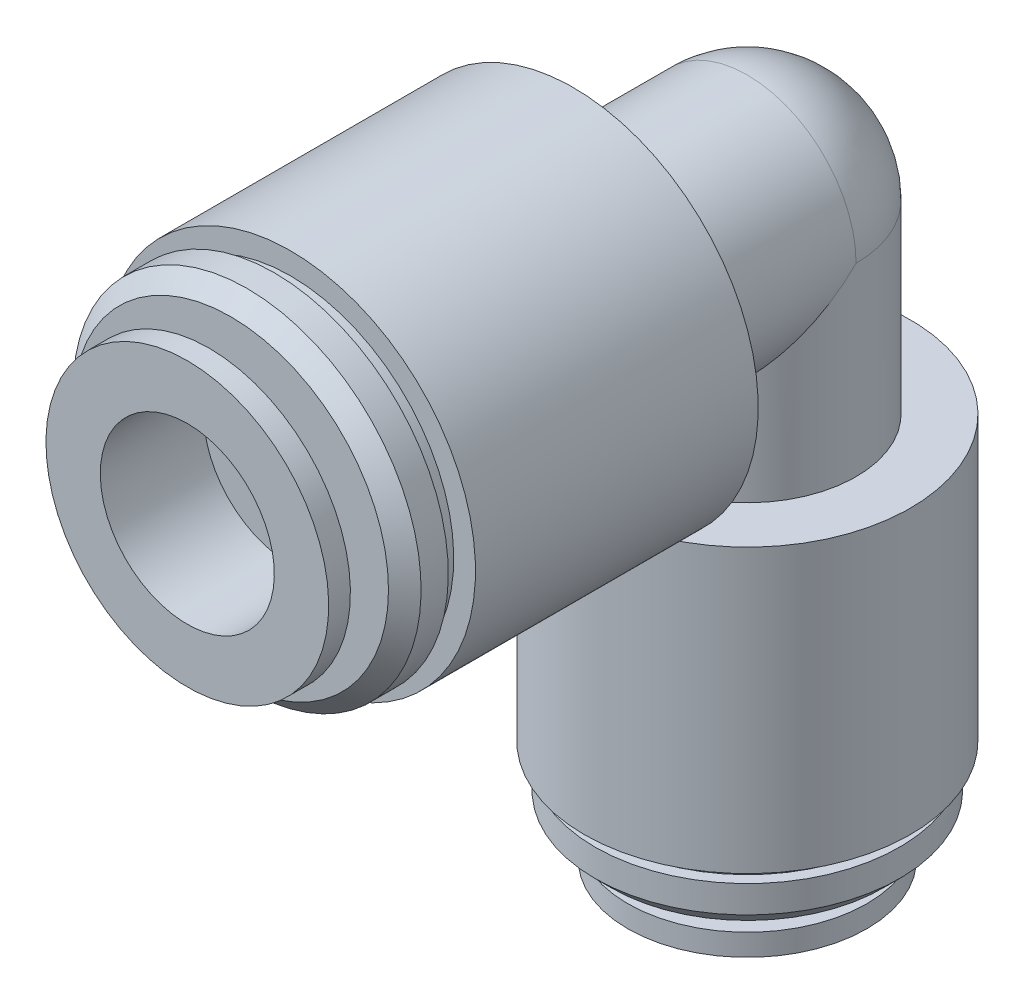
from build123d import *
from build123d.topology import SkipClean

# Parameters (mm, degrees)
SKETCH_3_R      = 5
EXTRUDE_2_DEPTH = 8
SKETCH_4_R      = 8.5
EXTRUDE_3_DEPTH = 13
EXTRUDE_START   = 3.5
SKETCH_7_R      = 5
EXTRUDE_4_DEPTH = 3.5
SKETCH_8_R      = 7.5
EXTRUDE_6_DEPTH = 13


with BuildPart() as part:
    # Эскиз2 → Повернуть1 (revolve)
    with BuildSketch(Plane.XY, mode=Mode.PRIVATE) as revolve_1_sk:
        with BuildLine():
            Line((0, 25), (0, 35))
            ThreePointArc((0, 35), (3.535533906, 33.535533906), (5, 30))
            Line((5, 30), (5, 25))
            Line((5, 25), (0, 25))
        make_face()
    revolve(revolve_1_sk.sketch.rotate(Axis((0, 25, 0), (0, 1, 0)), 90), axis=Axis((0, 25, 0), (0, 1, 0)))

    # Эскиз3 → Бобышка-Вытянуть2 (add)
    with SkipClean():  # the faces are left unmerged after this step: merging them gives an invalid solid
        with BuildSketch(Plane.XY):
            with Locations((0, 30)):
                Circle(SKETCH_3_R)
        extrude(amount=EXTRUDE_2_DEPTH)

    # Эскиз4 → Бобышка-Вытянуть3 (add)
    with SkipClean():  # the faces are left unmerged after this step: merging them gives an invalid solid
        with BuildSketch(Plane.XY.offset(8)):
            with Locations(Location((0, 30, 0), (0, 0, 180))):
                Circle(SKETCH_4_R)
        extrude(amount=EXTRUDE_3_DEPTH)

    # Эскиз7 → Бобышка-Вытянуть4 (add)
    with BuildSketch(Plane.XZ.offset(-25).offset(EXTRUDE_START)):
        with Locations(Location((0, 0, 0), (0, 0, 270))):
            Circle(SKETCH_7_R)
    extrude(amount=-EXTRUDE_4_DEPTH)

    # Эскиз8 → Бобышка-Вытянуть6 (add)
    with BuildSketch(Plane.XZ.offset(-21.5)):
        with Locations(Location((0, 0, 0), (0, 0, 90))):
            Circle(SKETCH_8_R)
    extrude(amount=EXTRUDE_6_DEPTH)

    # Эскиз9 → Повернуть5 (revolve)
    with BuildSketch(Plane(origin=(0, 0, 0), x_dir=(0, 0, -1), z_dir=(1, 0, 0)), mode=Mode.PRIVATE) as revolve_5_sk:
        Polygon((5.5, 4.75), (3.5, 4.75), (3.5, 5.75), (6.25, 5.75), (7, 6.5), (7, 7.75), (6.5, 7.75), (6.5, 8.5), (3, 8.5), (3, 3.75), (5.5, 3.75), align=None)
    revolve(revolve_5_sk.sketch.rotate(Axis((0, 8.5, 0), (0, -1, 0)), 180), axis=Axis((0, 8.5, 0), (0, -1, 0)))

    # Эскиз5 → Повернуть6 (revolve)
    with BuildSketch(Plane(origin=(0, 0, 0), x_dir=(0, 0, -1), z_dir=(1, 0, 0)), mode=Mode.PRIVATE) as revolve_6_sk:
        Polygon((-24.75, 23.5), (-24.75, 25.5), (-23.75, 25.5), (-23.75, 22.75), (-23, 22), (-21.75, 22), (-21.75, 22.5), (-21, 22.5), (-21, 26), (-25.75, 26), (-25.75, 23.5), align=None)
    revolve(revolve_6_sk.sketch.rotate(Axis((0, 30, 21), (0, 0, 1)), 180), axis=Axis((0, 30, 21), (0, 0, 1)))


solid = part.part
